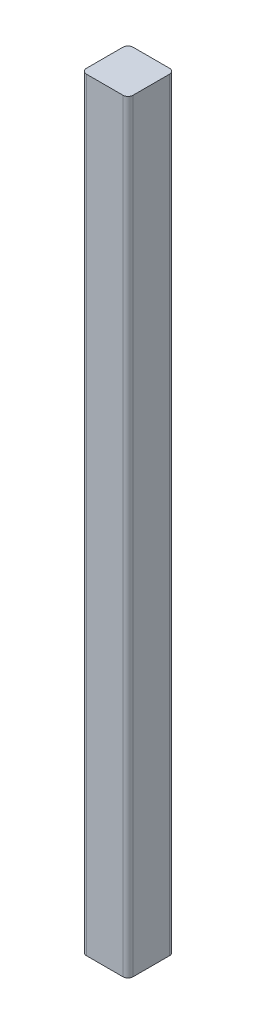
from build123d import *

# Parameters (mm, degrees)
BOSS_EXTRUDE1_DEPTH = 419.01
SKETCH3_W           = 20
SKETCH3_H           = 20
CUT_EXTRUDE1_DEPTH  = 408.5


with BuildPart() as part:
    # Sketch1 → Boss-Extrude1 (new body)
    with BuildSketch(Plane(origin=(0, 0, 0), x_dir=(1, 0, 0), z_dir=(0, 1, 0))):
        with BuildLine():
            Line((2.8, 0), (22.8, 0))
            ThreePointArc((22.8, 0), (24.779898987, -0.820101013), (25.6, -2.8))
            Line((25.6, -2.8), (25.6, -22.8))
            ThreePointArc((25.6, -22.8), (24.779898987, -24.779898987), (22.8, -25.6))
            Line((22.8, -25.6), (2.8, -25.6))
            ThreePointArc((2.8, -25.6), (0.820101013, -24.779898987), (0, -22.8))
            Line((0, -22.8), (0, -2.8))
            ThreePointArc((0, -2.8), (0.820101013, -0.820101013), (2.8, 0))
        make_face()
    extrude(amount=BOSS_EXTRUDE1_DEPTH)

    # Sketch3 → Cut-Extrude1 (cut)
    with BuildSketch(Plane(origin=(0, 0, 0), x_dir=(-1, 0, 0), z_dir=(0, -1, 0))):
        with Locations((-12.8, -12.8)):
            Rectangle(SKETCH3_W, SKETCH3_H)
    extrude(amount=-CUT_EXTRUDE1_DEPTH, mode=Mode.SUBTRACT)


solid = part.part
